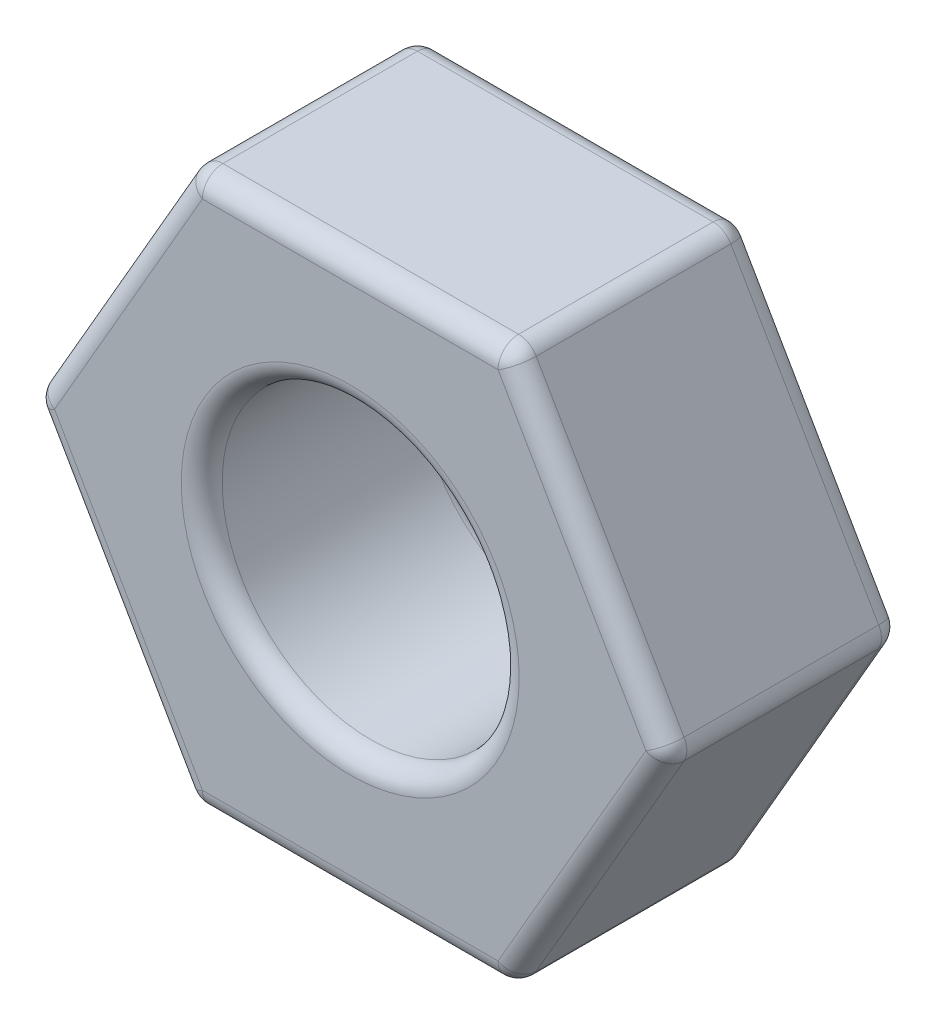
from build123d import *

# Parameters (mm, degrees)
ESBO_O1_R                = 1.45
RESSALTO_EXTRUS_O1_DEPTH = 2.3
FILETE1_R                = 0.2


with BuildPart() as part:
    # Esboço1 → Ressalto-extrusão1 (new body)
    with BuildSketch(Plane.XY):
        Polygon((-3.117691454, 0), (-1.558845727, -2.7), (1.558845727, -2.7), (3.117691454, 0), (1.558845727, 2.7), (-1.558845727, 2.7), align=None)
        Circle(ESBO_O1_R, mode=Mode.SUBTRACT)
    extrude(amount=RESSALTO_EXTRUS_O1_DEPTH)

    # Filete1
    filete1_edges = [part.edges().sort_by_distance(p)[0] for p in [
        (-1.558845727, 2.7, 1.15),
        (1.558845727, 2.7, 1.15),
        (3.117691454, 0, 1.15),
        (1.558845727, -2.7, 1.15),
        (-1.558845727, -2.7, 1.15),
        (-3.117691454, 0, 1.15),
        (0, -2.7, 2.3),
        (2.33826859, -1.35, 2.3),
        (-1.45, 0, 0),
        (-1.45, 0, 2.3),
        (2.33826859, 1.35, 2.3),
        (0, 2.7, 2.3),
        (-2.33826859, 1.35, 2.3),
        (0, 2.7, 0),
        (2.33826859, 1.35, 0),
        (2.33826859, -1.35, 0),
        (0, -2.7, 0),
        (-2.33826859, -1.35, 0),
        (-2.33826859, 1.35, 0),
        (-2.33826859, -1.35, 2.3),
    ]]
    fillet(filete1_edges, radius=FILETE1_R)


solid = part.part
